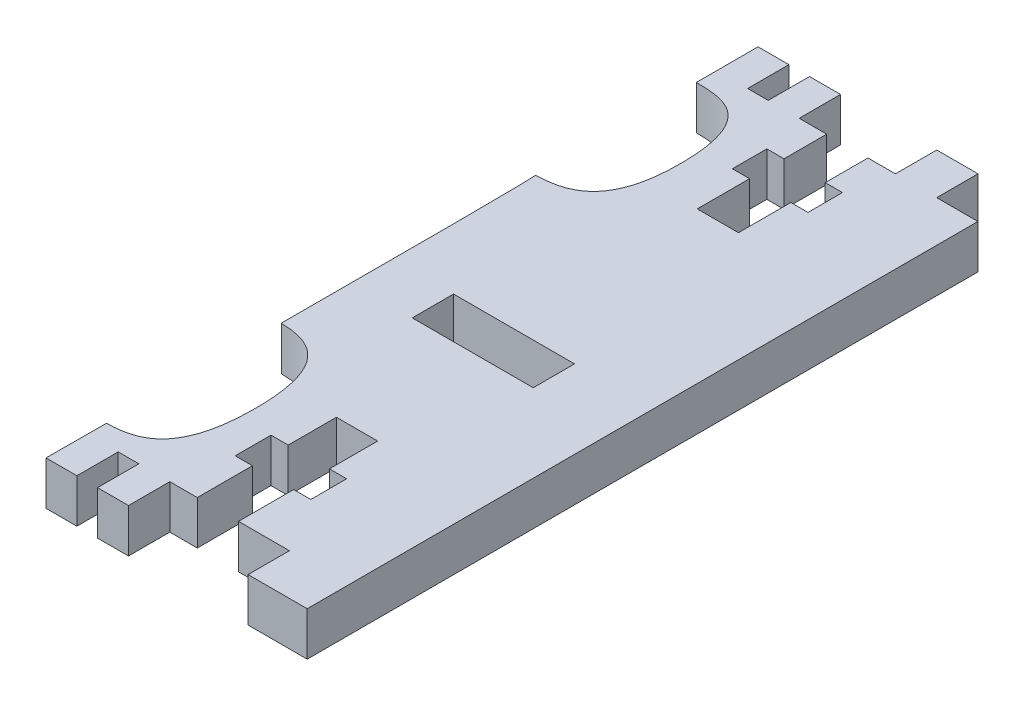
from build123d import *

# Parameters (mm, degrees)
SKETCH1_W           = 8.784371833
SKETCH1_H           = 3.000075643
BOSS_EXTRUDE1_DEPTH = 3.175


with BuildPart() as part:
    # Sketch1 → Boss-Extrude1 (new body)
    with BuildSketch(Plane(origin=(0, 0, 0), x_dir=(1, 0, 0), z_dir=(0, 1, 0))):
        with BuildLine():
            add(Edge.make_bspline(
                [(-28.61031783, -15.731991288), (-28.599265415, -13.470035002), (-28.589694066, -11.351623557)],
                knots=[4, 4, 4, 4.067001907, 4.067001907, 4.067001907], degree=2))
            Line((-28.61031783, -15.731991288), (-26.367380226, -15.731991288))
            Line((-26.367380226, -15.731991288), (-26.367380226, -12.731847281))
            Line((-26.367380226, -12.731847281), (-24.870018528, -12.731847281))
            Line((-24.870018528, -12.731847281), (-24.870018528, -15.731991288))
            Line((-24.870018528, -15.731991288), (-22.620949028, -15.731991288))
            Line((-22.620949028, -15.731991288), (-22.620949028, -12.731847281))
            Line((-22.620949028, -12.731847281), (-20.62449601, -12.731847281))
            Line((-20.62449601, -12.731847281), (-20.62449601, -8.731700034))
            Line((-20.62449601, -8.731700034), (-21.872234059, -8.731700034))
            Line((-21.872234059, -8.731700034), (-21.872234059, -8.631722416))
            Line((-21.872234059, -8.631722416), (-21.872234059, -6.131583692))
            Line((-21.872234059, -6.131583692), (-20.62449601, -6.131583692))
            Line((-20.62449601, -6.131583692), (-20.62449601, -2.631434402))
            Line((-20.62449601, -2.631434402), (-17.629967586, -2.631434402))
            Line((-17.629967586, -2.631434402), (-17.629967586, -6.131583692))
            Line((-17.629967586, -6.131583692), (-16.382151548, -6.131583692))
            Line((-16.382151548, -6.131583692), (-16.382151548, -8.631722416))
            Line((-16.382151548, -8.631722416), (-16.382151548, -8.731700034))
            Line((-16.382151548, -8.731700034), (-17.629967586, -8.731700034))
            Line((-17.629967586, -8.731700034), (-17.629967586, -12.731847281))
            Line((-17.629967586, -12.731847281), (-13.936374012, -12.731847281))
            Line((-13.936374012, -12.731847281), (-13.936374012, -15.731991288))
            Line((-13.936374012, -15.731991288), (-9.644077522, -15.731991288))
            Line((-9.644077522, -15.731991288), (-9.644077522, 32.969811886))
            Line((-9.644077522, 32.969811886), (-12.638791169, 32.969811886))
            Line((-12.638791169, 32.969811886), (-12.638791169, 35.969951009))
            Line((-12.638791169, 35.969951009), (-15.633504817, 35.969951009))
            Line((-15.633504817, 35.969951009), (-15.633504817, 32.969811886))
            Line((-15.633504817, 32.969811886), (-17.629967584, 32.969811886))
            Line((-17.629967584, 32.969811886), (-17.629967584, 29.869690261))
            Line((-17.629967584, 29.869690261), (-16.382151546, 29.869690261))
            Line((-16.382151546, 29.869690261), (-16.382151546, 27.369615017))
            Line((-16.382151546, 27.369615017), (-17.629967584, 27.369615017))
            Line((-17.629967584, 27.369615017), (-17.629967584, 23.569352199))
            Line((-17.629967584, 23.569352199), (-20.624496008, 23.569352199))
            Line((-20.624496008, 23.569352199), (-20.624496008, 27.369615017))
            Line((-20.624496008, 27.369615017), (-21.872234057, 27.369615017))
            Line((-21.872234057, 27.369615017), (-21.872234057, 29.869690261))
            Line((-21.872234057, 29.869690261), (-20.624496008, 29.869690261))
            Line((-20.624496008, 29.869690261), (-20.624496008, 32.969811886))
            Line((-20.624496008, 32.969811886), (-22.620949026, 32.969811886))
            Line((-22.620949026, 32.969811886), (-22.620949026, 35.969951009))
            Line((-22.620949026, 35.969951009), (-24.870018526, 35.969951009))
            Line((-24.870018526, 35.969951009), (-24.870018526, 32.969811886))
            Line((-24.870018526, 32.969811886), (-26.367380224, 32.969811886))
            Line((-26.367380224, 32.969811886), (-26.367380224, 35.969951009))
            Line((-26.367380224, 35.969951009), (-28.610317827, 35.969951009))
            Line((-28.610317827, 35.969951009), (-28.610317827, 31.489897526))
            add(Edge.make_bspline(
                [(-24.079715861, 26.005231108), (-24.142399609, 31.393191619), (-26.553744953, 31.462825341), (-28.610317827, 31.489897526)],
                knots=[6, 6, 6, 6, 7, 7, 7, 7], degree=3))
            add(Edge.make_bspline(
                [(-28.610317828, 19.811970764), (-26.367380222, 19.876359983), (-24.017041861, 20.617148519), (-24.079715861, 26.005231108)],
                knots=[5, 5, 5, 5, 6, 6, 6, 6], degree=3))
            add(Edge.make_bspline(
                [(-28.542036738, 1.284383122), (-28.493620066, 18.549619675), (-28.610317828, 19.811970764)],
                knots=[4.292555269, 4.292555269, 4.292555269, 5, 5, 5], degree=2))
            add(Edge.make_bspline(
                [(-28.542036738, 1.284383122), (-26.304598455, 1.216834034), (-24.092636702, 0.462074592), (-24.122268671, -5.143929938)],
                knots=[1.002428408, 1.002428408, 1.002428408, 1.002428408, 2, 2, 2, 2], degree=3))
            add(Edge.make_bspline(
                [(-24.122268671, -5.143929938), (-24.151883253, -10.744553605), (-26.537723417, -11.321030016), (-28.589694066, -11.351623557)],
                knots=[2, 2, 2, 2, 2.996659117, 2.996659117, 2.996659117, 2.996659117], degree=3))
        make_face()
        with Locations((-19.726124806, 7.868969519)):
            Rectangle(SKETCH1_W, SKETCH1_H, mode=Mode.SUBTRACT)
    extrude(amount=BOSS_EXTRUDE1_DEPTH)


solid = part.part
